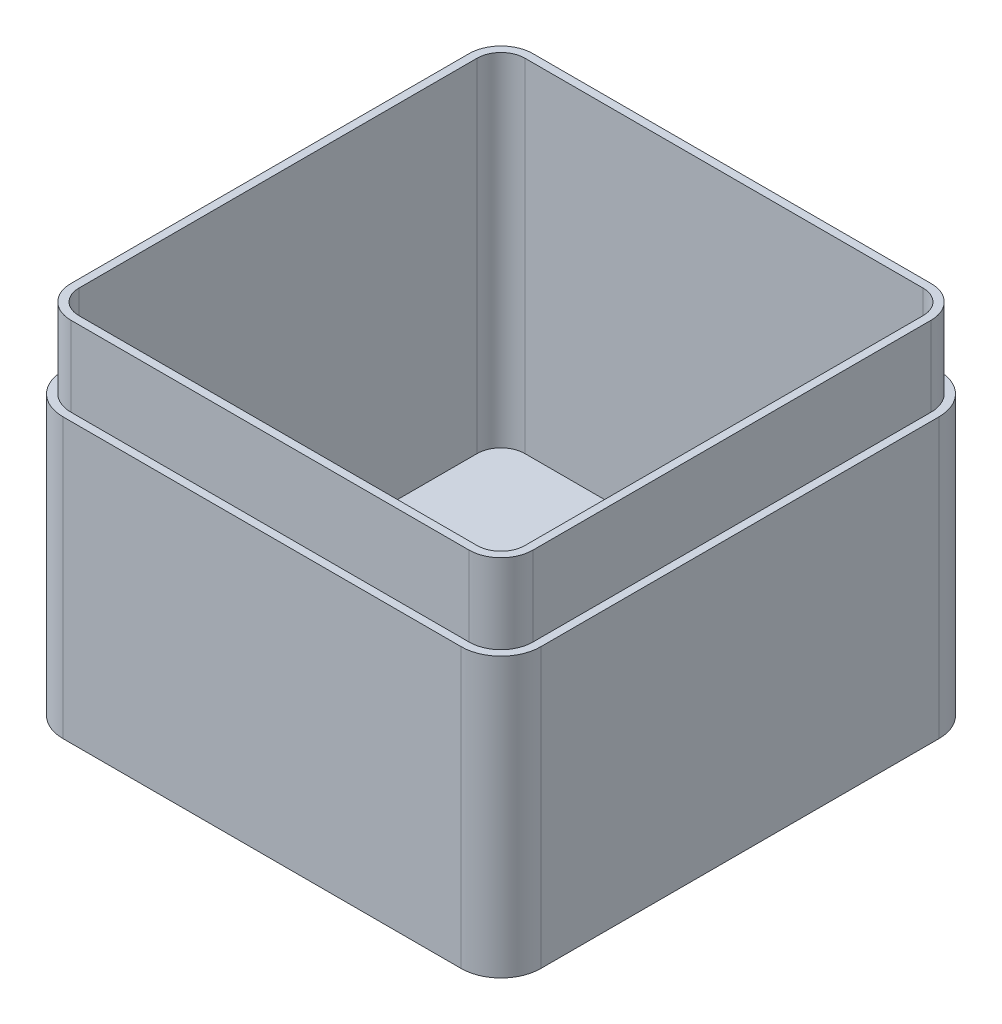
from build123d import *

# Parameters (mm, degrees)
SKETCH1_W           = 120
SKETCH1_H           = 120
BOSS_EXTRUDE1_DEPTH = 90
FILLET1_R           = 10
SHELL1_T            = -4
CUT_EXTRUDE1_DEPTH  = 20


with BuildPart() as part:
    # Sketch1 → Boss-Extrude1 (new body)
    with BuildSketch(Plane(origin=(0, 0, 0), x_dir=(1, 0, 0), z_dir=(0, 1, 0))):
        Rectangle(SKETCH1_W, SKETCH1_H)
    extrude(amount=BOSS_EXTRUDE1_DEPTH)

    # Fillet1
    fillet1_edges = [part.edges().sort_by_distance(p)[0] for p in [
        (60, 45, 60),
        (-60, 45, 60),
        (-60, 45, -60),
        (60, 45, -60),
    ]]
    fillet(fillet1_edges, radius=FILLET1_R)

    # Shell1
    shell1_openings = [part.faces().sort_by_distance(p)[0] for p in [
        (0, 90, 0),
    ]]
    offset(amount=SHELL1_T, openings=shell1_openings, kind=Kind.INTERSECTION)

    # Sketch3 → Cut-Extrude1 (cut)
    with BuildSketch(Plane(origin=(0, 90, 0), x_dir=(1, 0, 0), z_dir=(0, 1, 0))):
        with BuildLine():
            ThreePointArc((50, -60), (57.071067812, -57.071067812), (60, -50))
            Line((60, -50), (60, 50))
            ThreePointArc((60, 50), (57.071067812, 57.071067812), (50, 60))
            Line((50, 60), (-50, 60))
            ThreePointArc((-50, 60), (-57.071067812, 57.071067812), (-60, 50))
            Line((-60, 50), (-60, -50))
            ThreePointArc((-60, -50), (-57.071067812, -57.071067812), (-50, -60))
            Line((-50, -60), (50, -60))
        make_face()
        with BuildLine():
            ThreePointArc((50, -58), (55.656854249, -55.656854249), (58, -50))
            Line((58, -50), (58, 50))
            ThreePointArc((58, 50), (55.656854249, 55.656854249), (50, 58))
            Line((50, 58), (-50, 58))
            ThreePointArc((-50, 58), (-55.656854249, 55.656854249), (-58, 50))
            Line((-58, 50), (-58, -50))
            ThreePointArc((-58, -50), (-55.656854249, -55.656854249), (-50, -58))
            Line((-50, -58), (50, -58))
        make_face(mode=Mode.SUBTRACT)
    extrude(amount=-CUT_EXTRUDE1_DEPTH, mode=Mode.SUBTRACT)


solid = part.part
